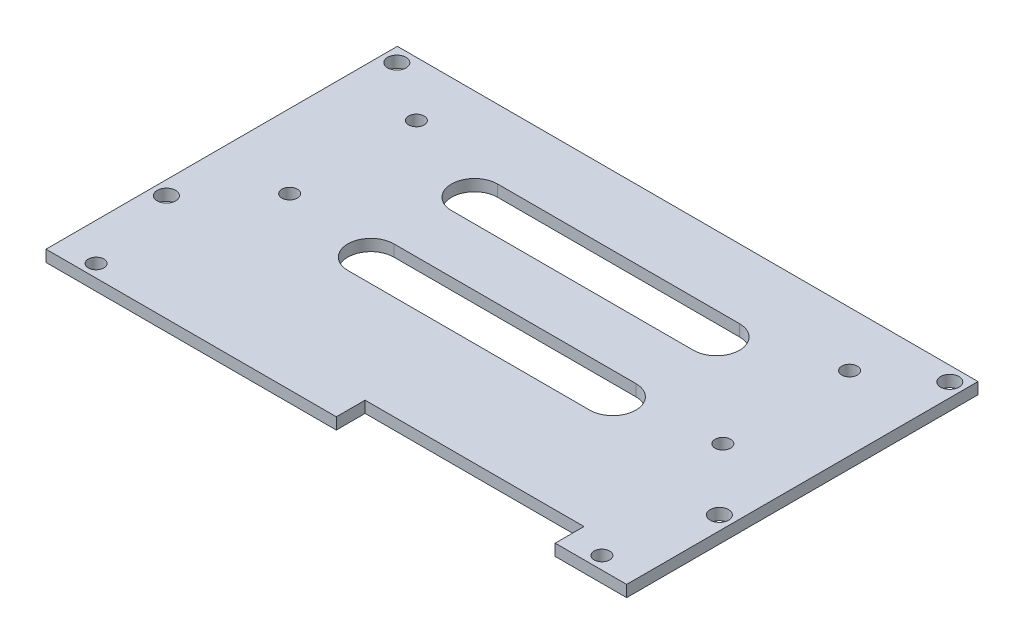
from build123d import *

# Parameters (mm, degrees)
SKETCH_1_R          = 1.6
SKETCH_1_R_2        = 1.35
EXTRUDE_1_DEPTH     = 2
CUT_EXTRUDE_1_REACH = 62.829
SKETCH_2_W          = 38
SKETCH_2_H          = 12.009324428


with BuildPart() as part:
    # 草图1 → 凸台-拉伸1 (new body)
    with BuildSketch(Plane(origin=(0, 0, 0), x_dir=(1, 0, 0), z_dir=(0, 1, 0))):
        Polygon((-40.4, -27), (40.4, -27), (50.4, -27), (50.4, 27), (50.4, 34), (-50.4, 34), (-50.4, 27), (-50.4, -27), align=None)
        with Locations(Location((-48, 31.5, 0), (0, 0, 270))):
            Circle(SKETCH_1_R, mode=Mode.SUBTRACT)
        with Locations(Location((-37.6, 24.5, 0), (0, 0, 270))):
            Circle(SKETCH_1_R_2, mode=Mode.SUBTRACT)
        with Locations(Location((-43.9, -24.8, 0), (0, 0, 270))):
            Circle(SKETCH_1_R_2, mode=Mode.SUBTRACT)
        with Locations(Location((37.6, 24.5, 0), (0, 0, 90))):
            Circle(SKETCH_1_R_2, mode=Mode.SUBTRACT)
        with Locations(Location((43.9, -24.8, 0), (0, 0, 90))):
            Circle(SKETCH_1_R_2, mode=Mode.SUBTRACT)
        with Locations(Location((-48, -8.5, 0), (0, 0, 270))):
            Circle(SKETCH_1_R, mode=Mode.SUBTRACT)
        with Locations(Location((48, -8.5, 0), (0, 0, 90))):
            Circle(SKETCH_1_R, mode=Mode.SUBTRACT)
        with Locations(Location((48, 31.5, 0), (0, 0, 90))):
            Circle(SKETCH_1_R, mode=Mode.SUBTRACT)
        with Locations(Location((-37.6, 2.5, 0), (0, 0, 270))):
            Circle(SKETCH_1_R_2, mode=Mode.SUBTRACT)
        with Locations(Location((37.6, 2.5, 0), (0, 0, 90))):
            Circle(SKETCH_1_R_2, mode=Mode.SUBTRACT)
        with BuildLine():
            Line((-21, 22), (21, 22))
            ThreePointArc((21, 22), (25, 18), (21, 14))
            Line((21, 14), (-21, 14))
            ThreePointArc((-21, 14), (-25, 18), (-21, 22))
        make_face(mode=Mode.SUBTRACT)
        with BuildLine():
            Line((-21, 4), (21, 4))
            ThreePointArc((21, 4), (25, 0), (21, -4))
            Line((21, -4), (-21, -4))
            ThreePointArc((-21, -4), (-25, 0), (-21, 4))
        make_face(mode=Mode.SUBTRACT)
    extrude(amount=EXTRUDE_1_DEPTH)

    # 草图2 → 切除-拉伸1 (cut, up to next)
    with BuildSketch(Plane.XZ, mode=Mode.PRIVATE) as cut_extrude_1_sk1:
        with Locations((19, 28.004662214)):
            Rectangle(SKETCH_2_W, SKETCH_2_H)
    cut_extrude_1_tool1 = extrude(cut_extrude_1_sk1.sketch, amount=-CUT_EXTRUDE_1_REACH, mode=Mode.PRIVATE) & part.part
    add(cut_extrude_1_tool1.solids().sort_by_distance((19, 0, 28.004662))[0], mode=Mode.SUBTRACT)


solid = part.part
